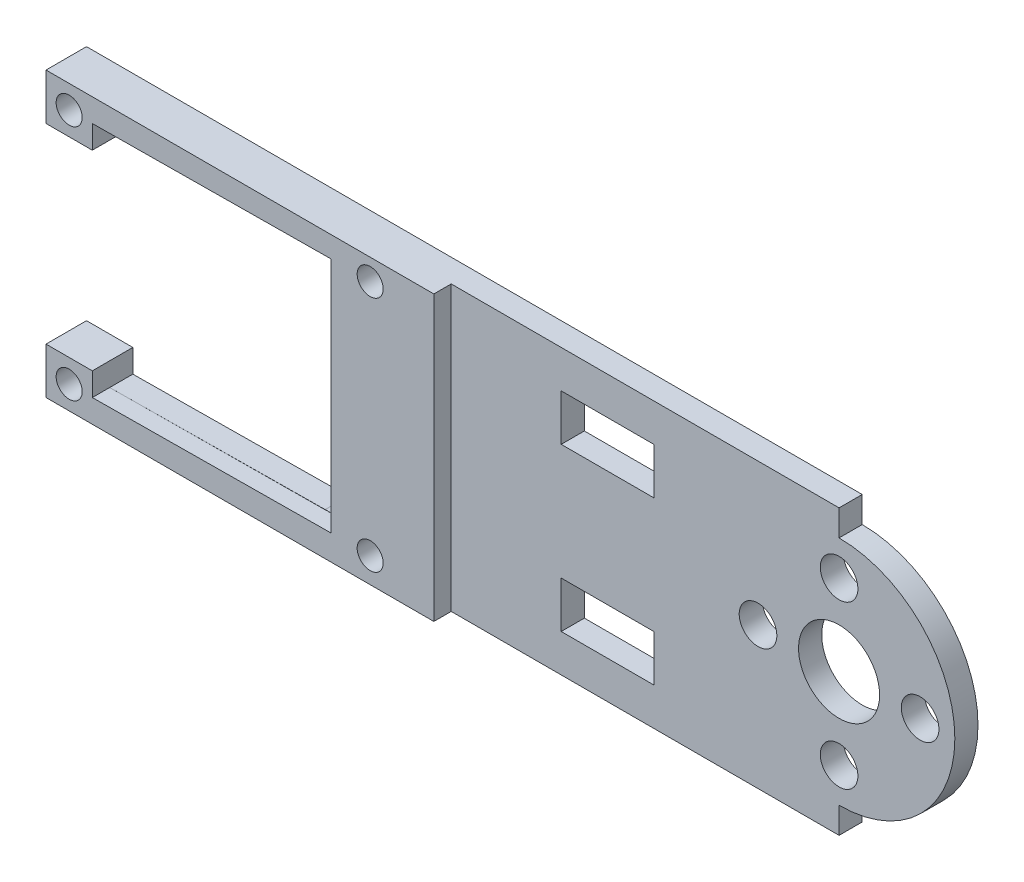
from build123d import *

# Parameters (mm, degrees)
SKETCH1_R           = 1.625
SKETCH1_R_2         = 3.5
SKETCH1_R_3         = 1.125
SKETCH1_W           = 8
SKETCH1_H           = 4
BOSS_EXTRUDE1_DEPTH = 2
SKETCH8_R           = 1.125
BOSS_EXTRUDE4_DEPTH = 1.5


with BuildPart() as part:
    # Sketch1 → Boss-Extrude1 (new body)
    with BuildSketch(Plane.XY):
        with BuildLine():
            Line((-29, -8.25), (-29, -12.25))
            Line((-29, -12.25), (38, -12.25))
            Line((38, -12.25), (38, -10))
            ThreePointArc((38, -10), (48, 0), (38, 10))
            Line((38, 10), (38, 12.25))
            Line((38, 12.25), (-29, 12.25))
            Line((-29, 12.25), (-29, 8.25))
            Line((-29, 8.25), (-25, 8.25))
            Line((-25, 8.25), (-25, 10.25))
            Line((-25, 10.25), (-6.3848969, 10.429151381))
            Line((-6.3848969, 10.429151381), (-4.383484917, 10.429151381))
            Line((-4.383484917, 10.429151381), (-4.383484917, -10.070848619))
            Line((-4.383484917, -10.070848619), (-6.3848969, -10.070848619))
            Line((-6.3848969, -10.070848619), (-25, -10.25))
            Line((-25, -10.25), (-25, -8.25))
            Line((-25, -8.25), (-29, -8.25))
        make_face()
        with Locations((38, 7)):
            Circle(SKETCH1_R, mode=Mode.SUBTRACT)
        with Locations((45, 0)):
            Circle(SKETCH1_R, mode=Mode.SUBTRACT)
        with Locations((38, -7)):
            Circle(SKETCH1_R, mode=Mode.SUBTRACT)
        with Locations((31, 0)):
            Circle(SKETCH1_R, mode=Mode.SUBTRACT)
        with Locations((38, 0)):
            Circle(SKETCH1_R_2, mode=Mode.SUBTRACT)
        with Locations((-27, 10.25)):
            Circle(SKETCH1_R_3, mode=Mode.SUBTRACT)
        with Locations((-27, -10.25)):
            Circle(SKETCH1_R_3, mode=Mode.SUBTRACT)
        with Locations((-1, 10.429151381)):
            Circle(SKETCH1_R_3, mode=Mode.SUBTRACT)
        with Locations((-1, -10.070848619)):
            Circle(SKETCH1_R_3, mode=Mode.SUBTRACT)
        with Locations((18, 7)):
            Rectangle(SKETCH1_W, SKETCH1_H, mode=Mode.SUBTRACT)
        with Locations((18, -7)):
            Rectangle(SKETCH1_W, SKETCH1_H, mode=Mode.SUBTRACT)
    extrude(amount=BOSS_EXTRUDE1_DEPTH)

    # Sketch8 → Boss-Extrude4 (add)
    with BuildSketch(Plane.XY.offset(2)):
        Polygon((-29, 12.25), (4.5, 12.25), (4.5, -12.25), (-29, -12.25), (-29, -8.25), (-25, -8.25), (-25, -10.25), (-4.383484917, -10.070848619), (-4.383484917, 10.429151381), (-25, 10.25), (-25, 8.25), (-29, 8.25), align=None)
        with Locations((-27, 10.25)):
            Circle(SKETCH8_R, mode=Mode.SUBTRACT)
        with Locations((-27, -10.25)):
            Circle(SKETCH8_R, mode=Mode.SUBTRACT)
        with Locations((-1, 10.429151381)):
            Circle(SKETCH8_R, mode=Mode.SUBTRACT)
        with Locations((-1, -10.070848619)):
            Circle(SKETCH8_R, mode=Mode.SUBTRACT)
    extrude(amount=BOSS_EXTRUDE4_DEPTH)


solid = part.part
